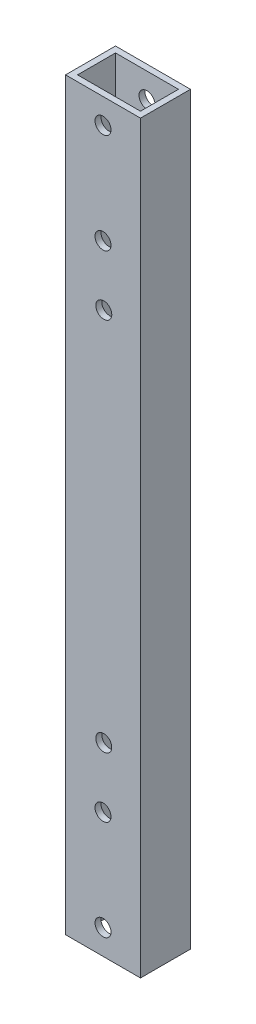
from build123d import *

# Parameters (mm, degrees)
SKETCH_1_W          = 15
SKETCH_1_H          = 10
SKETCH_1_W_2        = 12.6
SKETCH_1_H_2        = 7.6
EXTRUDE_1_DEPTH     = 74.51
SKETCH_3_R          = 1.6
CUT_EXTRUDE_1_DEPTH = 10
SKETCH_4_R          = 1.6
CUT_EXTRUDE_2_DEPTH = 10


with BuildPart() as part:
    # ｽｹｯﾁ1 → ﾎﾞｽ - 押し出し1 (new, symmetric)
    with BuildSketch(Plane(origin=(0, 0, 0), x_dir=(1, 0, 0), z_dir=(0, 1, 0))):
        Rectangle(SKETCH_1_W, SKETCH_1_H)
        Rectangle(SKETCH_1_W_2, SKETCH_1_H_2, mode=Mode.SUBTRACT)
    extrude(amount=EXTRUDE_1_DEPTH, both=True)

    # ｽｹｯﾁ3 → ｶｯﾄ - 押し出し1 (cut)
    with BuildSketch(Plane.XY.offset(5)):
        with Locations((0, 49.51)):
            Circle(SKETCH_3_R)
        with Locations((0, 69.51)):
            Circle(SKETCH_3_R)
    cut_extrude_1 = extrude(amount=-CUT_EXTRUDE_1_DEPTH, mode=Mode.SUBTRACT)

    # ﾐﾗｰ1: ｶｯﾄ - 押し出し1 across plane
    add(cut_extrude_1.mirror(Plane.ZX), mode=Mode.SUBTRACT)

    # ｽｹｯﾁ4 → ｶｯﾄ - 押し出し2 (cut)
    with BuildSketch(Plane(origin=(0, 0, -5), x_dir=(-1, 0, 0), z_dir=(0, 0, -1))):
        with Locations((-0.155, 37.579058048)):
            Circle(SKETCH_4_R)
        with Locations((-0.150000602, -37.420941952)):
            Circle(SKETCH_4_R)
    extrude(amount=-CUT_EXTRUDE_2_DEPTH, mode=Mode.SUBTRACT)


solid = part.part
